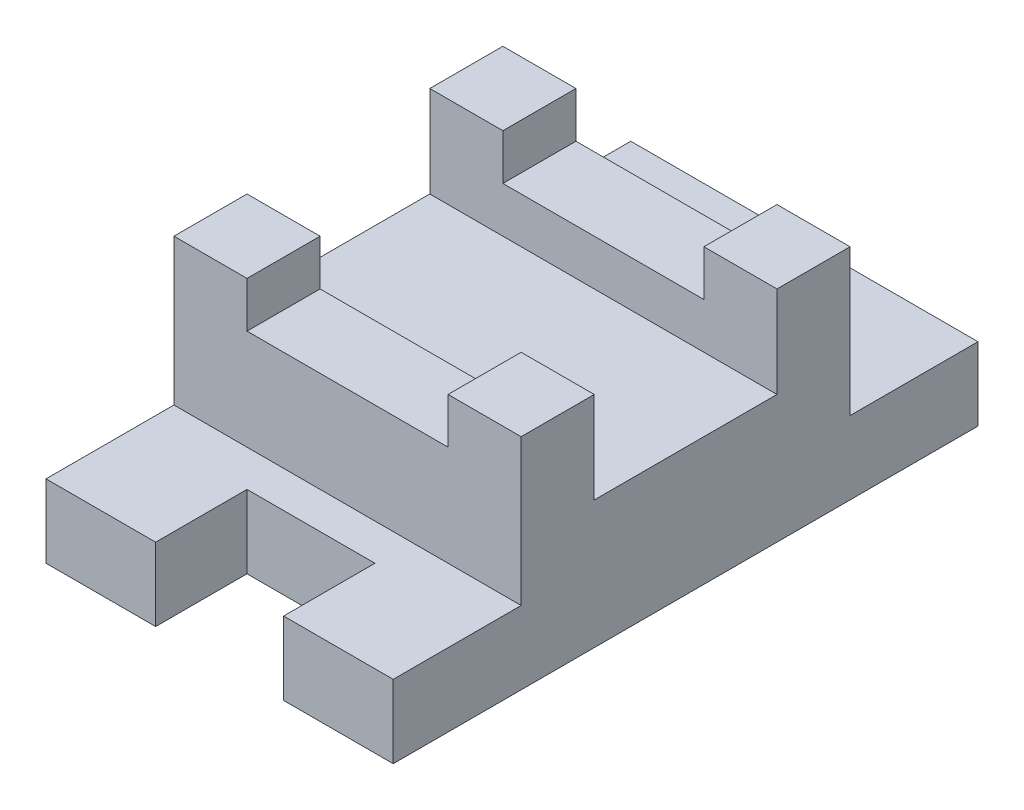
from build123d import *

# Parameters (mm, degrees)
BOSS_EXTRUDE1_DEPTH = 38
SKETCH2_W           = 22
SKETCH2_H           = 10
CUT_EXTRUDE1_DEPTH  = 72.593579496
SKETCH3_W           = 14
SKETCH3_H           = 20
CUT_EXTRUDE2_DEPTH  = 59.5


with BuildPart() as part:
    # Sketch1 → Boss-Extrude1 (new body)
    with BuildSketch(Plane(origin=(0, 0, 0), x_dir=(0, 0, -1), z_dir=(1, 0, 0))):
        Polygon((41.5, 10.375), (-22.5, 10.375), (-22.5, 18.375), (-8.5, 18.375), (-8.5, 34.375), (-0.5, 34.375), (-0.5, 24.375), (19.5, 24.375), (19.5, 34.375), (27.5, 34.375), (27.5, 18.375), (41.5, 18.375), align=None)
    extrude(amount=BOSS_EXTRUDE1_DEPTH)

    # Sketch2 → Cut-Extrude1 (cut, through all)
    with BuildSketch(Plane.XY.offset(8.5)):
        with Locations((19, 34.375)):
            Rectangle(SKETCH2_W, SKETCH2_H)
    extrude(amount=-CUT_EXTRUDE1_DEPTH, mode=Mode.SUBTRACT)

    # Sketch3 → Cut-Extrude2 (cut, through all)
    with BuildSketch(Plane(origin=(0, 18.375, 0), x_dir=(1, 0, 0), z_dir=(0, 1, 0))):
        with Locations((19, -22.5)):
            Rectangle(SKETCH3_W, SKETCH3_H)
    extrude(amount=-CUT_EXTRUDE2_DEPTH, mode=Mode.SUBTRACT)


solid = part.part
